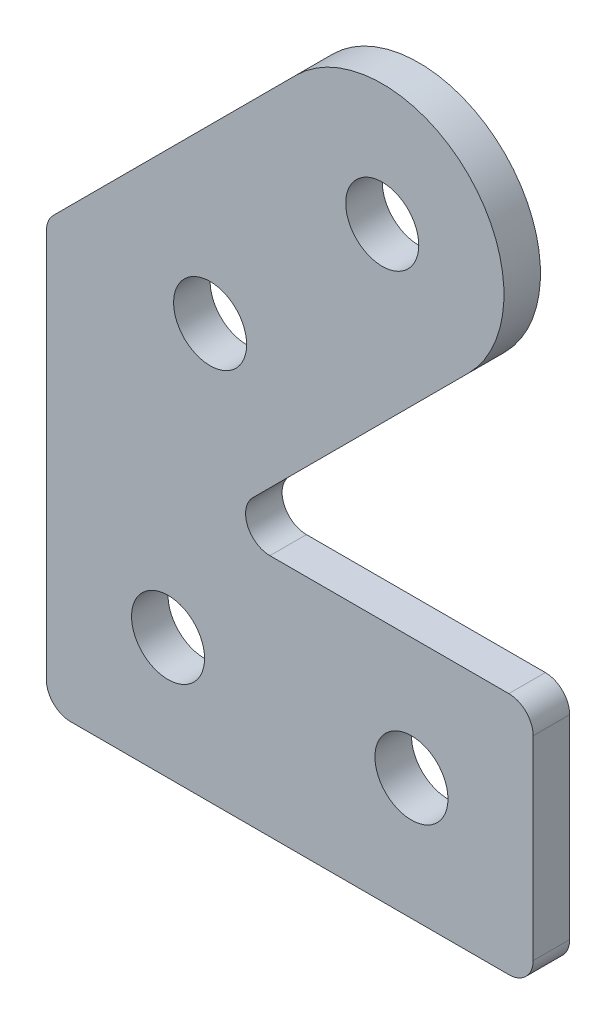
from build123d import *

# Parameters (mm, degrees)
SCHIZZO1_W                   = 20
SCHIZZO1_H                   = 10
ESTRUSIONE_ESTRUSIONE1_DEPTH = 1.5
FORO_3_0_3_1_D               = 3
ESTRUSIONE_ESTRUSIONE3_DEPTH = 1.5
FORO_3_0_3_4_D               = 3
RACCORDO2_R                  = 1


with BuildPart() as part:
    # Schizzo1 → Estrusione-Estrusione1 (new body)
    with BuildSketch(Plane.XY):
        with Locations((10, 5)):
            Rectangle(SCHIZZO1_W, SCHIZZO1_H)
    extrude(amount=ESTRUSIONE_ESTRUSIONE1_DEPTH)

    # Foro Ø3.0 (3)-1 (through all)
    with Locations(Plane.XY.offset(1.5)):
        with Locations((5, 5), (15, 5)):
            Hole(FORO_3_0_3_1_D / 2)

    # Schizzo9 → Estrusione-Estrusione3 (add)
    with BuildSketch(Plane.XY):
        with BuildLine():
            Line((0, 17.371067812), (0, 10))
            Line((0, 10), (6.771067812, 10))
            Line((6.771067812, 10), (17.335533906, 20.564466094))
            ThreePointArc((17.335533906, 20.564466094), (17.335533906, 27.635533906), (10.264466094, 27.635533906))
            Line((10.264466094, 27.635533906), (0, 17.371067812))
        make_face()
    extrude(amount=ESTRUSIONE_ESTRUSIONE3_DEPTH)

    # Foro Ø3.0 (3)-4 (through all)
    with Locations(Plane.XY.offset(1.5)):
        with Locations((13.8, 24.1), (6.728932188, 17.028932188)):
            Hole(FORO_3_0_3_4_D / 2)

    # Raccordo2
    raccordo2_edges = [part.edges().sort_by_distance(p)[0] for p in [
        (0, 0, 0.75),
        (20, 0, 0.75),
        (20, 10, 0.75),
        (6.771067812, 10, 0.75),
        (0, 17.371067812, 0.75),
    ]]
    fillet(raccordo2_edges, radius=RACCORDO2_R)


solid = part.part
